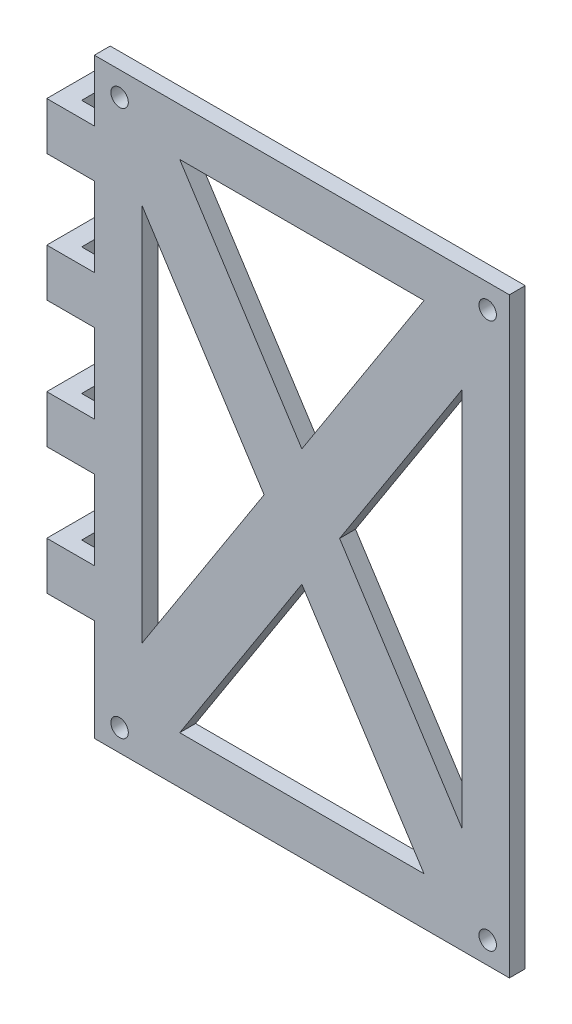
from build123d import *

# Parameters (mm, degrees)
SKETCH1_W                = 90
SKETCH1_H                = 100
BOSS_EXTRUDE1_DEPTH      = 1.25
CUT_EXTRUDE2_DEPTH       = 68.314560089
CUT_EXTRUDE2_DEPTH_BACK  = 68.314560089
SKETCH3_W                = 120.524160128
SKETCH3_H                = 121.100830751
SKETCH3_W_2              = 90
SKETCH3_H_2              = 100
BOSS_EXTRUDE2_DEPTH      = 10
BOSS_EXTRUDE2_DEPTH_BACK = 1
SKETCH4_W                = 3
SKETCH4_H                = 7.5
CUT_EXTRUDE4_DEPTH       = 85.83221669
CUT_EXTRUDE4_DEPTH_BACK  = 85.83221669
SKETCH6_R                = 1.5
HOLDER_SCREW_DEPTH       = 65.47473997
HOLDER_SCREW_DEPTH_BACK  = 65.47473997
SKETCH11_R               = 1.375


with BuildPart() as part:
    # Sketch1 → Boss-Extrude1 (new, symmetric)
    with BuildSketch(Plane.XY):
        Rectangle(SKETCH1_W, SKETCH1_H)
    extrude(amount=BOSS_EXTRUDE1_DEPTH, both=True)

    # Sketch3 → Cut-Extrude2 (cut, two sides: drawn at the far end of the back side and taken through both)
    # profile 1 of 6: a face of its own
    with BuildSketch(Plane(origin=(0, 0, -1.25), x_dir=(-1, 0, 0), z_dir=(0, 0, -1)).offset(-CUT_EXTRUDE2_DEPTH_BACK)):
        with Locations((6.594005418, 0.079563665)):
            Rectangle(SKETCH3_W, SKETCH3_H)
        Rectangle(SKETCH3_W_2, SKETCH3_H_2, mode=Mode.SUBTRACT)
    # profile 2 of 6: a face of its own
    with BuildSketch(Plane(origin=(0, 0, -1.25), x_dir=(-1, 0, 0), z_dir=(0, 0, -1)).offset(-CUT_EXTRUDE2_DEPTH_BACK)):
        Rectangle(SKETCH3_W_2, SKETCH3_H_2)
        Polygon((42.616130373, -30.674442955), (35.116130373, -30.674442955), (35.116130373, -33.902086325), (35.116130373, -46.739785261), (-30.279040864, -46.739785261), (-30.279040864, 46.489928229), (35.116130373, 46.489928229), (35.116130373, 36.825557045), (42.616130373, 36.825557045), (42.616130373, 29.325557045), (35.116130373, 29.325557045), (35.116130373, 16.825557045), (42.616130373, 16.825557045), (42.616130373, 9.325557045), (35.116130373, 9.325557045), (35.116130373, -3.174442955), (42.616130373, -3.174442955), (42.616130373, -10.674442955), (35.116130373, -10.674442955), (35.116130373, -23.174442955), (42.616130373, -23.174442955), align=None, mode=Mode.SUBTRACT)
    # profile 3 of 6: a face of its own
    with BuildSketch(Plane(origin=(0, 0, -1.25), x_dir=(-1, 0, 0), z_dir=(0, 0, -1)).offset(-CUT_EXTRUDE2_DEPTH_BACK)):
        Polygon((-16.831379802, 38.989928229), (2.418544754, 9.1077779), (21.668469311, 38.989928229), align=None)
    # profile 4 of 6: a face of its own
    with BuildSketch(Plane(origin=(0, 0, -1.25), x_dir=(-1, 0, 0), z_dir=(0, 0, -1)).offset(-CUT_EXTRUDE2_DEPTH_BACK)):
        Polygon((-22.779040864, 29.757221813), (-22.779040864, -30.007078845), (-3.529116308, -0.124928516), align=None)
    # profile 5 of 6: a face of its own
    with BuildSketch(Plane(origin=(0, 0, -1.25), x_dir=(-1, 0, 0), z_dir=(0, 0, -1)).offset(-CUT_EXTRUDE2_DEPTH_BACK)):
        Polygon((2.418544754, -9.357634932), (21.668469311, -39.239785261), (-16.831379802, -39.239785261), align=None)
    # profile 6 of 6: a face of its own
    with BuildSketch(Plane(origin=(0, 0, -1.25), x_dir=(-1, 0, 0), z_dir=(0, 0, -1)).offset(-CUT_EXTRUDE2_DEPTH_BACK)):
        Polygon((8.366205816, -0.124928516), (27.616130373, 29.757221813), (27.616130373, -30.007078845), align=None)
    extrude(amount=CUT_EXTRUDE2_DEPTH + CUT_EXTRUDE2_DEPTH_BACK, mode=Mode.SUBTRACT)

    # Sketch4 → Boss-Extrude2 (add, two sides: drawn at the far end of the back side and taken through both)
    with BuildSketch(Plane(origin=(0, 0, -1.25), x_dir=(-1, 0, 0), z_dir=(0, 0, -1)).offset(-BOSS_EXTRUDE2_DEPTH_BACK)):
        with Locations((41.116130373, 33.075557045)):
            Rectangle(SKETCH4_W, SKETCH4_H)
        with Locations((41.116130373, 13.075557045)):
            Rectangle(SKETCH4_W, SKETCH4_H)
        with Locations((41.116130373, -6.924442955)):
            Rectangle(SKETCH4_W, SKETCH4_H)
        with Locations((41.116130373, -26.924442955)):
            Rectangle(SKETCH4_W, SKETCH4_H)
    extrude(amount=BOSS_EXTRUDE2_DEPTH + BOSS_EXTRUDE2_DEPTH_BACK)

    # Sketch6 → Cut-Extrude4 (cut, two sides: drawn at the far end of the back side and taken through both)
    with BuildSketch(Plane(origin=(-39.616130373, 0, 0), x_dir=(0, 0, -1), z_dir=(1, 0, 0)).offset(-CUT_EXTRUDE4_DEPTH_BACK)):
        with Locations((6.568537773, 33.075557045)):
            Circle(SKETCH6_R)
        with BuildLine():
            Line((11.25, 33.075557045), (11.25, 36.825557045))
            Line((11.25, 36.825557045), (7.5, 36.825557045))
            ThreePointArc((7.5, 36.825557045), (10.151650429, 35.727207475), (11.25, 33.075557045))
        make_face()
        with BuildLine():
            Line((11.25, 29.325557045), (11.25, 33.075557045))
            ThreePointArc((11.25, 33.075557045), (10.151650429, 30.423906616), (7.5, 29.325557045))
            Line((7.5, 29.325557045), (11.25, 29.325557045))
        make_face()
        with Locations((6.568537773, 13.075557045)):
            Circle(SKETCH6_R)
        with BuildLine():
            Line((11.25, 9.325557045), (11.25, 13.075557045))
            ThreePointArc((11.25, 13.075557045), (10.151650429, 10.423906616), (7.5, 9.325557045))
            Line((7.5, 9.325557045), (11.25, 9.325557045))
        make_face()
        with BuildLine():
            Line((11.25, 13.075557045), (11.25, 16.825557045))
            Line((11.25, 16.825557045), (7.5, 16.825557045))
            ThreePointArc((7.5, 16.825557045), (10.151650429, 15.727207475), (11.25, 13.075557045))
        make_face()
        with BuildLine():
            Line((11.25, -6.924442955), (11.25, -3.174442955))
            Line((11.25, -3.174442955), (7.5, -3.174442955))
            ThreePointArc((7.5, -3.174442955), (10.151650429, -4.272792525), (11.25, -6.924442955))
        make_face()
        with Locations((6.568537773, -6.924442955)):
            Circle(SKETCH6_R)
        with BuildLine():
            Line((11.25, -10.674442955), (11.25, -6.924442955))
            ThreePointArc((11.25, -6.924442955), (10.151650429, -9.576093384), (7.5, -10.674442955))
            Line((7.5, -10.674442955), (11.25, -10.674442955))
        make_face()
        with BuildLine():
            Line((11.25, -30.674442955), (11.25, -26.924442971))
            ThreePointArc((11.25, -26.924442971), (10.151650424, -29.57609339), (7.5, -30.674442955))
            Line((7.5, -30.674442955), (11.25, -30.674442955))
        make_face()
        with Locations((6.568537773, -26.924442955)):
            Circle(SKETCH6_R)
        with BuildLine():
            Line((11.25, -26.924442971), (11.25, -23.174442955))
            Line((11.25, -23.174442955), (7.5, -23.174442955))
            ThreePointArc((7.5, -23.174442955), (10.151650435, -24.272792531), (11.25, -26.924442971))
        make_face()
    extrude(amount=CUT_EXTRUDE4_DEPTH + CUT_EXTRUDE4_DEPTH_BACK, mode=Mode.SUBTRACT)

    # Sketch11 → Holder_Screw (cut, two sides: drawn at the far end of the back side and taken through both)
    with BuildSketch(Plane.XY.offset(1.25).offset(-HOLDER_SCREW_DEPTH_BACK)):
        with Locations(Location((-31.1419152, 42.7222856, 0), (0, 0, 180))):
            Circle(SKETCH11_R)
        with Locations(Location((26.8580848, 42.7222856, 0), (0, 0, 180))):
            Circle(SKETCH11_R)
        with Locations(Location((26.8580848, -43.2777144, 0), (0, 0, 180))):
            Circle(SKETCH11_R)
        with Locations(Location((-31.1419152, -43.2777144, 0), (0, 0, 180))):
            Circle(SKETCH11_R)
    extrude(amount=HOLDER_SCREW_DEPTH + HOLDER_SCREW_DEPTH_BACK, mode=Mode.SUBTRACT)


solid = part.part
